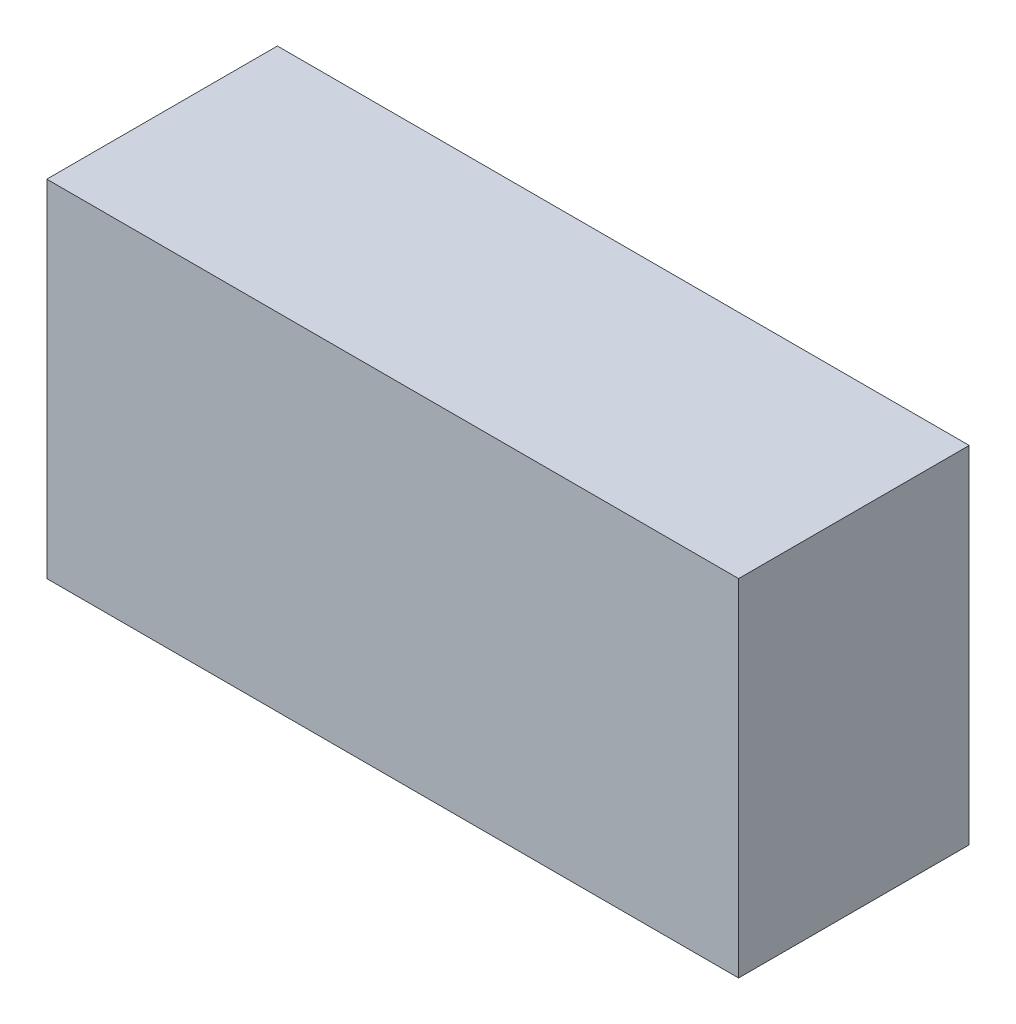
from build123d import *

# Parameters (mm, degrees)
SKETCH1_W           = 60
SKETCH1_H           = 30
BOSS_EXTRUDE1_DEPTH = 20


with BuildPart() as part:
    # Sketch1 → Boss-Extrude1 (new body)
    with BuildSketch(Plane.XY):
        with Locations((0, 15)):
            Rectangle(SKETCH1_W, SKETCH1_H)
    extrude(amount=BOSS_EXTRUDE1_DEPTH)


solid = part.part
